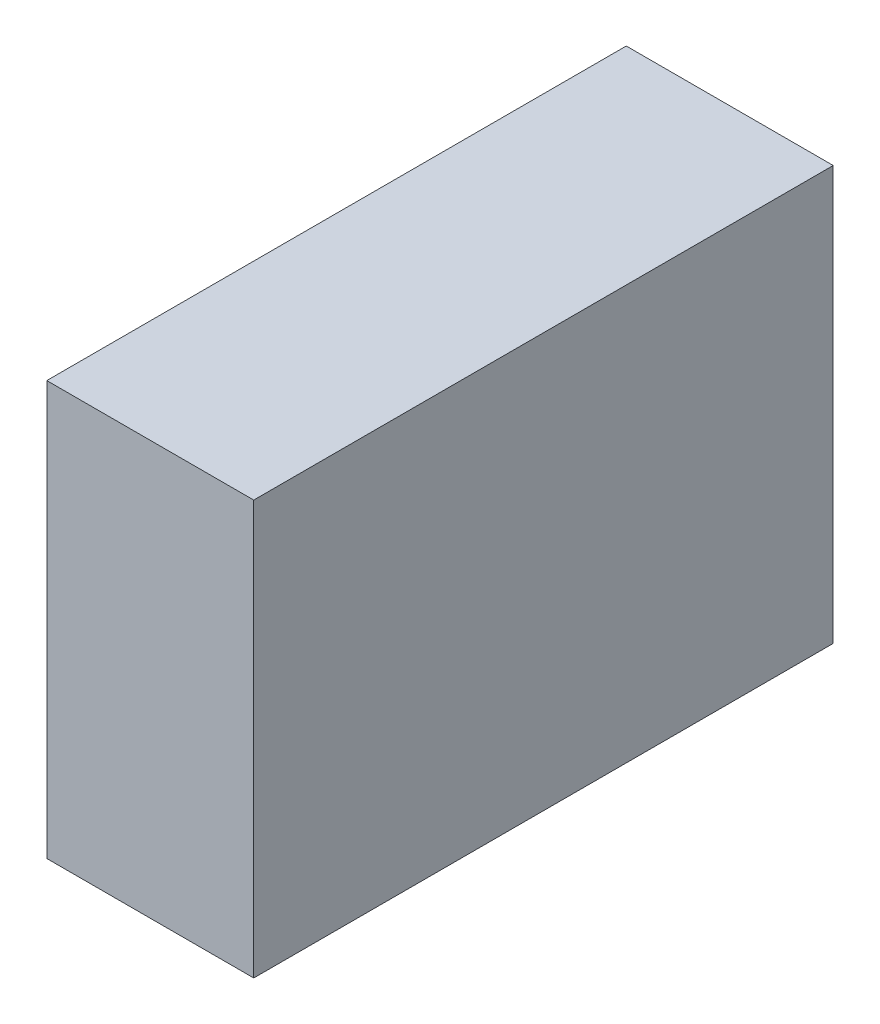
from build123d import *

# Parameters (mm, degrees)
SKIZZE1_W                       = 50
SKIZZE1_H                       = 100
AUFSATZ_LINEAR_AUSTRAGEN1_DEPTH = 140


with BuildPart() as part:
    # Skizze1 → Aufsatz-Linear austragen1 (new body)
    with BuildSketch(Plane.XY):
        with Locations((30.451993927, 56.28742515)):
            Rectangle(SKIZZE1_W, SKIZZE1_H)
    extrude(amount=AUFSATZ_LINEAR_AUSTRAGEN1_DEPTH)


solid = part.part
